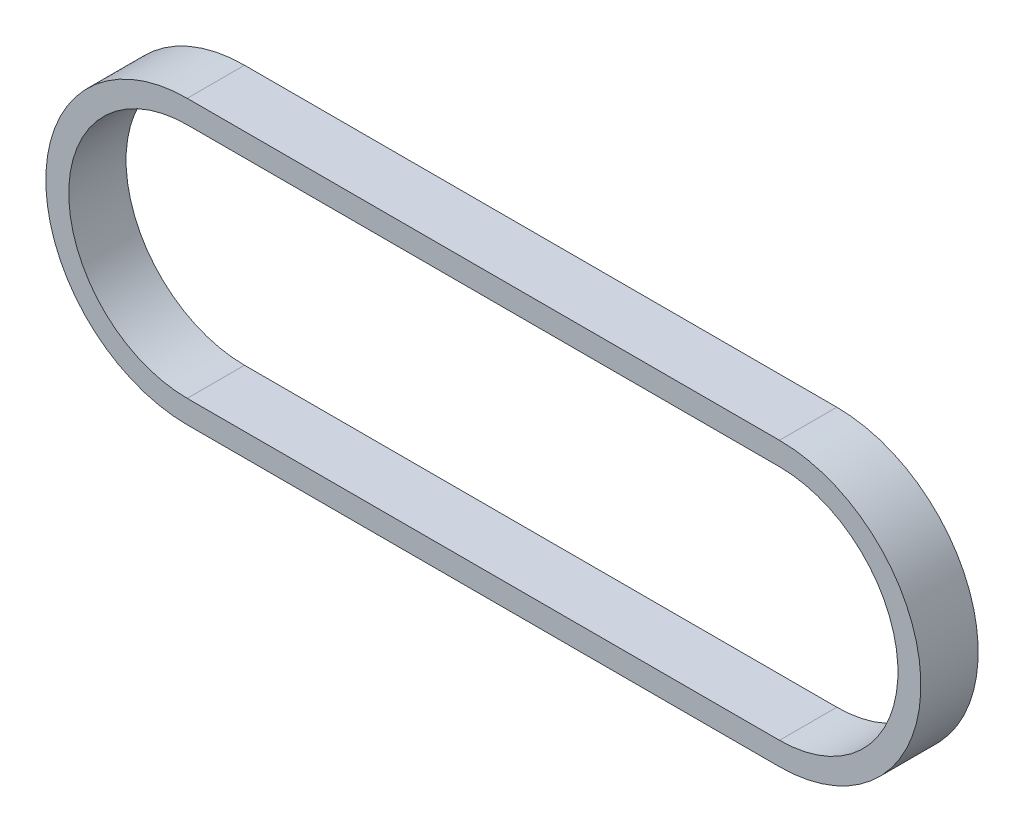
from build123d import *

# Parameters (mm, degrees)
BOSS_EXTRU_1_DEPTH = 6


with BuildPart() as part:
    # Esquisse1 → Boss.-Extru.1 (new body)
    with BuildSketch(Plane.XY):
        with BuildLine():
            Line((0, 14.8), (62, 14.8))
            ThreePointArc((62, 14.8), (76.8, 0), (62, -14.8))
            Line((62, -14.8), (0, -14.8))
            ThreePointArc((0, -14.8), (-14.8, 0), (0, 14.8))
        make_face()
        with BuildLine():
            Line((0, 12.4), (62, 12.4))
            ThreePointArc((62, 12.4), (74.4, 0), (62, -12.4))
            Line((62, -12.4), (0, -12.4))
            ThreePointArc((0, -12.4), (-12.4, 0), (0, 12.4))
        make_face(mode=Mode.SUBTRACT)
    extrude(amount=BOSS_EXTRU_1_DEPTH)


solid = part.part
